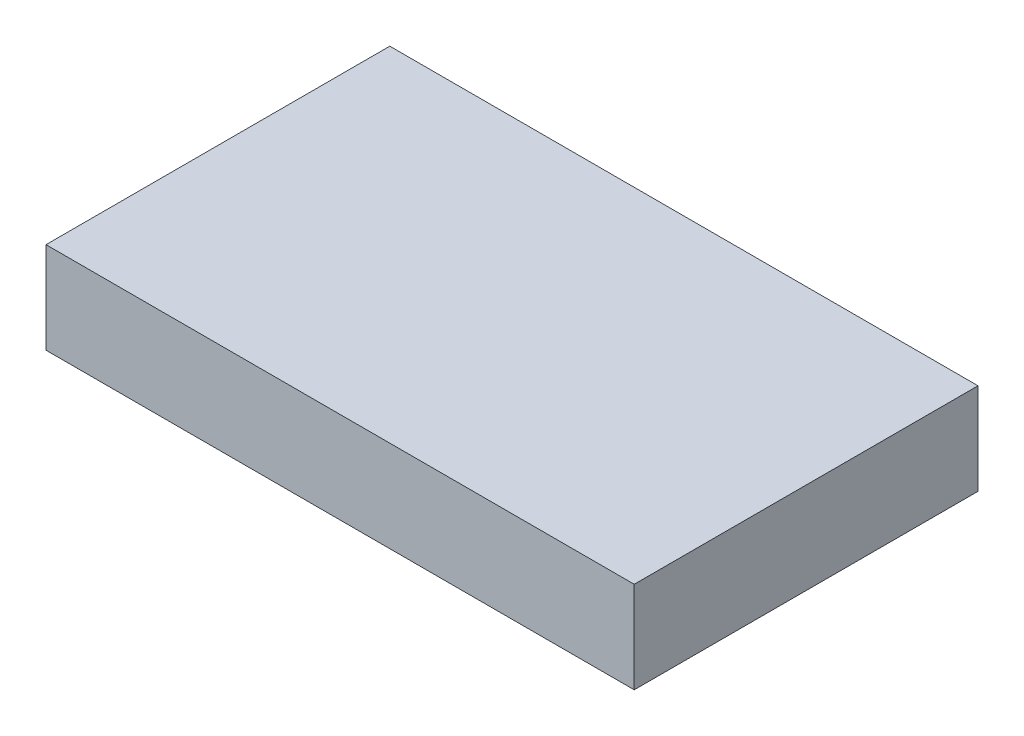
from build123d import *

# Parameters (mm, degrees)
SKETCH1_W           = 119.297395344
SKETCH1_H           = 69.723410683
BOSS_EXTRUDE1_DEPTH = 18.542


with BuildPart() as part:
    # Sketch1 → Boss-Extrude1 (new body)
    with BuildSketch(Plane(origin=(0, 0, 0), x_dir=(1, 0, 0), z_dir=(0, 1, 0))):
        with Locations((-11.354041648, 3.997901989)):
            Rectangle(SKETCH1_W, SKETCH1_H)
    extrude(amount=BOSS_EXTRUDE1_DEPTH)


solid = part.part
